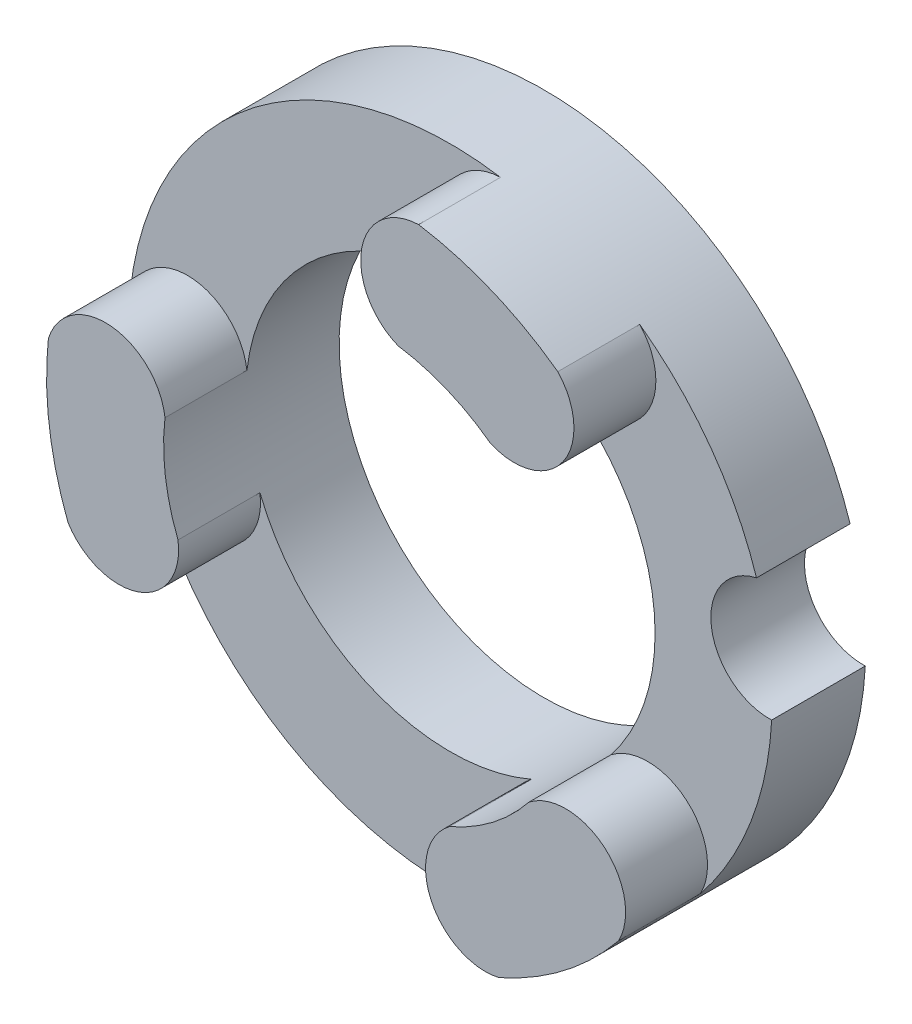
from build123d import *
from build123d.topology import SkipClean

# Parameters (mm, degrees)
SKETCH1_R           = 27.5
SKETCH1_R_2         = 17.5
BOSS_EXTRUDE1_DEPTH = 8
BOSS_EXTRUDE2_DEPTH = 7
SKETCH4_R           = 5
CUT_EXTRUDE1_DEPTH  = 40.705163392


with BuildPart() as part:
    # Sketch1 → Boss-Extrude1 (new body)
    with BuildSketch(Plane.XY):
        Circle(SKETCH1_R)
        Circle(SKETCH1_R_2, mode=Mode.SUBTRACT)
    extrude(amount=BOSS_EXTRUDE1_DEPTH)

    # Sketch2 → Boss-Extrude2 (add)
    with SkipClean():  # the faces are left unmerged after this step: merging them gives an invalid solid
        with BuildSketch(Plane.XY.offset(8)):
            with BuildLine():
                ThreePointArc((10.453586197, 14.034690435), (16.644995589, 15.807064972), (16.187563711, 22.230896993))
                ThreePointArc((16.187563711, 22.230896993), (10.533073102, 25.40284179), (4.293124723, 27.162825334))
                ThreePointArc((4.293124723, 27.162825334), (-0.575744113, 22.947498772), (2.54487111, 17.313972133))
                ThreePointArc((2.54487111, 17.313972133), (6.702864701, 16.165444776), (10.453586197, 14.034690435))
            make_face()
            with BuildLine():
                ThreePointArc((-17.38119155, 2.03572599), (-22.011817619, 6.51145654), (-27.3463034, 2.903392903))
                ThreePointArc((-27.3463034, 2.903392903), (-27.26604287, -3.579512009), (-25.670259139, -9.863457595))
                ThreePointArc((-25.670259139, -9.863457595), (-19.585244834, -11.972358414), (-16.266775263, -6.453063036))
                ThreePointArc((-16.266775263, -6.453063036), (-17.35111819, -2.277871278), (-17.38119155, 2.03572599))
            make_face()
            with BuildLine():
                ThreePointArc((21.377134416, -17.299367738), (20.160988946, -10.975140359), (13.721904153, -10.860909097))
                ThreePointArc((13.721904153, -10.860909097), (10.648253489, -13.887573497), (6.927605353, -16.070416425))
                ThreePointArc((6.927605353, -16.070416425), (5.36682203, -22.318521512), (11.158739689, -25.134289896))
                ThreePointArc((11.158739689, -25.134289896), (16.732969768, -21.823329781), (21.377134416, -17.299367738))
            make_face()
        extrude(amount=BOSS_EXTRUDE2_DEPTH)

    # Sketch4 → Cut-Extrude1 (cut, through all)
    with SkipClean():  # the faces are left unmerged after this step: merging them gives an invalid solid
        with BuildSketch(Plane.XY.offset(8)):
            with Locations((27.26604287, 3.579512009)):
                Circle(SKETCH4_R)
        extrude(amount=-CUT_EXTRUDE1_DEPTH, mode=Mode.SUBTRACT)


solid = part.part
